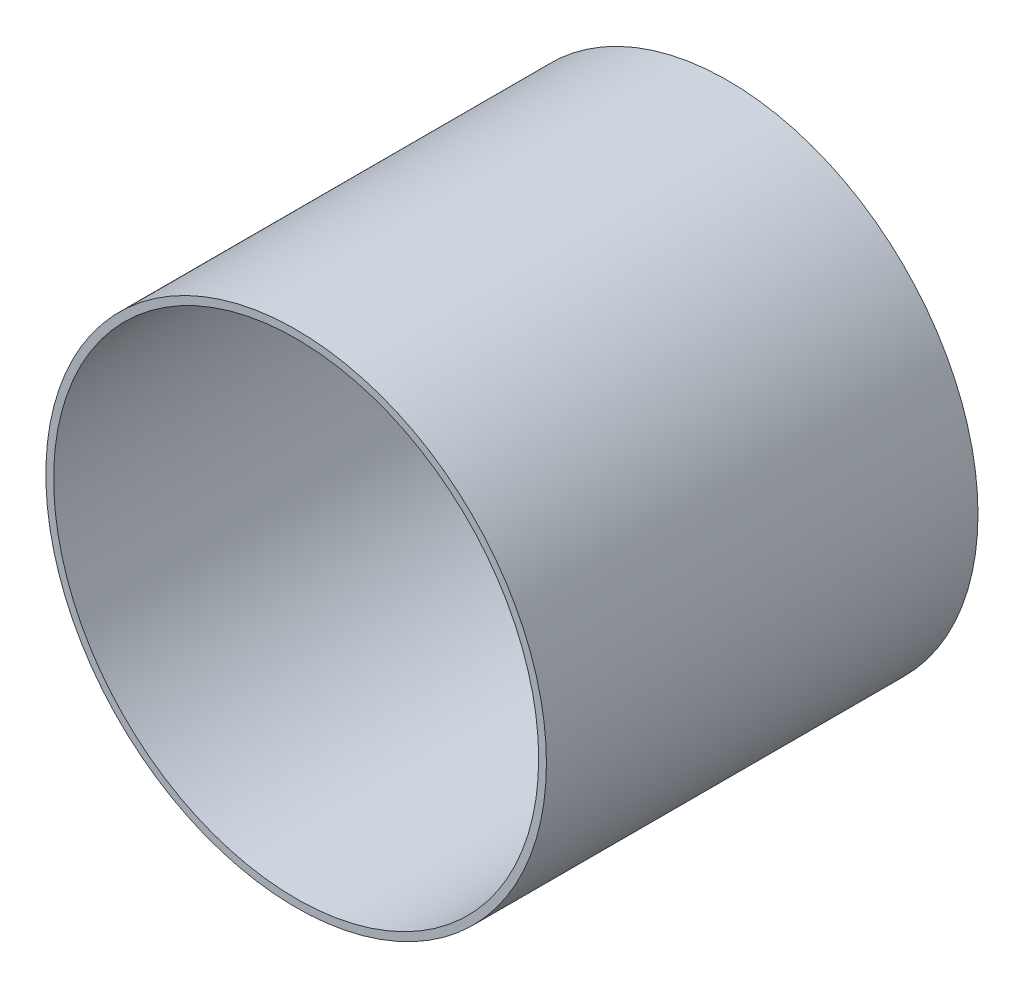
from build123d import *

# Parameters (mm, degrees)
SKETCH1_R           = 14.5
SKETCH1_R_2         = 14.05
BOSS_EXTRUDE1_DEPTH = 25


with BuildPart() as part:
    # Sketch1 → Boss-Extrude1 (new body)
    with BuildSketch(Plane.XY):
        Circle(SKETCH1_R)
        Circle(SKETCH1_R_2, mode=Mode.SUBTRACT)
    extrude(amount=BOSS_EXTRUDE1_DEPTH)


solid = part.part
